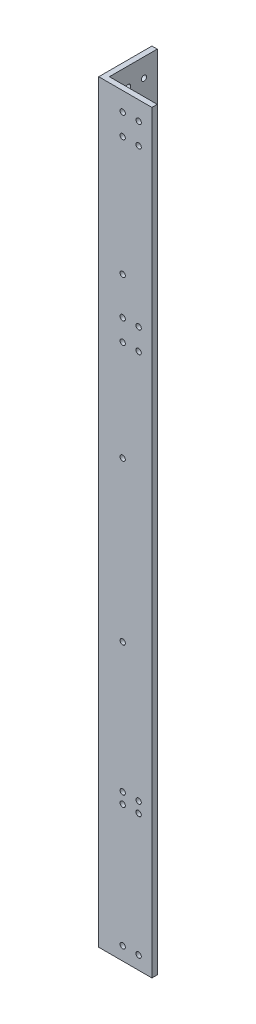
from build123d import *

# Parameters (mm, degrees)
BOSS_EXTRUDE1_DEPTH               = 450
RIGHTSIDEHOLES_SKETCH3_R          = 1.5875
RIGHTSIDEHOLES_CUT_EXTRUDE1_DEPTH = 3.175
FRONTSIDEHOLES_SKETCH4_R          = 1.5875
FRONTSIDEHOLES_CUT_EXTRUDE2_DEPTH = 3.175


with BuildPart() as part:
    # Sketch2 → Boss-Extrude1 (new body)
    with BuildSketch(Plane(origin=(0, 0, 0), x_dir=(1, 0, 0), z_dir=(0, 1, 0))):
        Polygon((0, 31.75), (3.175, 31.75), (3.175, 3.175), (31.75, 3.175), (31.75, 0), (0, 0), align=None)
    extrude(amount=BOSS_EXTRUDE1_DEPTH)

    # RightSideHoles-Sketch3 → RightSideHoles-Cut-Extrude1 (cut)
    with BuildSketch(Plane.XY):
        with Locations((14.2875, 81.1125)):
            Circle(RIGHTSIDEHOLES_SKETCH3_R)
        with Locations((23.8125, 81.1125)):
            Circle(RIGHTSIDEHOLES_SKETCH3_R)
        with Locations((14.2875, 87.4625)):
            Circle(RIGHTSIDEHOLES_SKETCH3_R)
        with Locations((23.8125, 87.4625)):
            Circle(RIGHTSIDEHOLES_SKETCH3_R)
        with Locations((14.2875, 438.8875)):
            Circle(RIGHTSIDEHOLES_SKETCH3_R)
        with Locations((14.2875, 426.1875)):
            Circle(RIGHTSIDEHOLES_SKETCH3_R)
        with Locations((23.8125, 438.8875)):
            Circle(RIGHTSIDEHOLES_SKETCH3_R)
        with Locations((23.8125, 426.1875)):
            Circle(RIGHTSIDEHOLES_SKETCH3_R)
        with Locations((14.2875, 332.602644)):
            Circle(RIGHTSIDEHOLES_SKETCH3_R)
        with Locations((23.8125, 332.602644)):
            Circle(RIGHTSIDEHOLES_SKETCH3_R)
        with Locations((14.2875, 319.902644)):
            Circle(RIGHTSIDEHOLES_SKETCH3_R)
        with Locations((23.8125, 319.902644)):
            Circle(RIGHTSIDEHOLES_SKETCH3_R)
        with Locations((14.2875, 7.9375)):
            Circle(RIGHTSIDEHOLES_SKETCH3_R)
        with Locations((23.8125, 7.9375)):
            Circle(RIGHTSIDEHOLES_SKETCH3_R)
        with Locations((14.2875, 165)):
            Circle(RIGHTSIDEHOLES_SKETCH3_R)
        with Locations((14.2875, 260)):
            Circle(RIGHTSIDEHOLES_SKETCH3_R)
        with Locations((14.2875, 355)):
            Circle(RIGHTSIDEHOLES_SKETCH3_R)
    extrude(amount=-RIGHTSIDEHOLES_CUT_EXTRUDE1_DEPTH, mode=Mode.SUBTRACT)

    # FrontSideHoles-Sketch4 → FrontSideHoles-Cut-Extrude2 (cut)
    with BuildSketch(Plane.ZY):
        with Locations((-23.8125, 81.1125)):
            Circle(FRONTSIDEHOLES_SKETCH4_R)
        with Locations((-14.2875, 81.1125)):
            Circle(FRONTSIDEHOLES_SKETCH4_R)
        with Locations((-23.8125, 87.4625)):
            Circle(FRONTSIDEHOLES_SKETCH4_R)
        with Locations((-14.2875, 87.4625)):
            Circle(FRONTSIDEHOLES_SKETCH4_R)
        with Locations((-23.8125, 438.8875)):
            Circle(FRONTSIDEHOLES_SKETCH4_R)
        with Locations((-14.2875, 438.8875)):
            Circle(FRONTSIDEHOLES_SKETCH4_R)
        with Locations((-23.8125, 426.1875)):
            Circle(FRONTSIDEHOLES_SKETCH4_R)
        with Locations((-14.2875, 426.1875)):
            Circle(FRONTSIDEHOLES_SKETCH4_R)
        with Locations((-14.2875, 338.177644)):
            Circle(FRONTSIDEHOLES_SKETCH4_R)
        with Locations((-14.2875, 319.652644)):
            Circle(FRONTSIDEHOLES_SKETCH4_R)
        with Locations((-14.2875, 165)):
            Circle(FRONTSIDEHOLES_SKETCH4_R)
        with Locations((-14.2875, 260)):
            Circle(FRONTSIDEHOLES_SKETCH4_R)
        with Locations((-14.2875, 355)):
            Circle(FRONTSIDEHOLES_SKETCH4_R)
    extrude(amount=-FRONTSIDEHOLES_CUT_EXTRUDE2_DEPTH, mode=Mode.SUBTRACT)


solid = part.part
